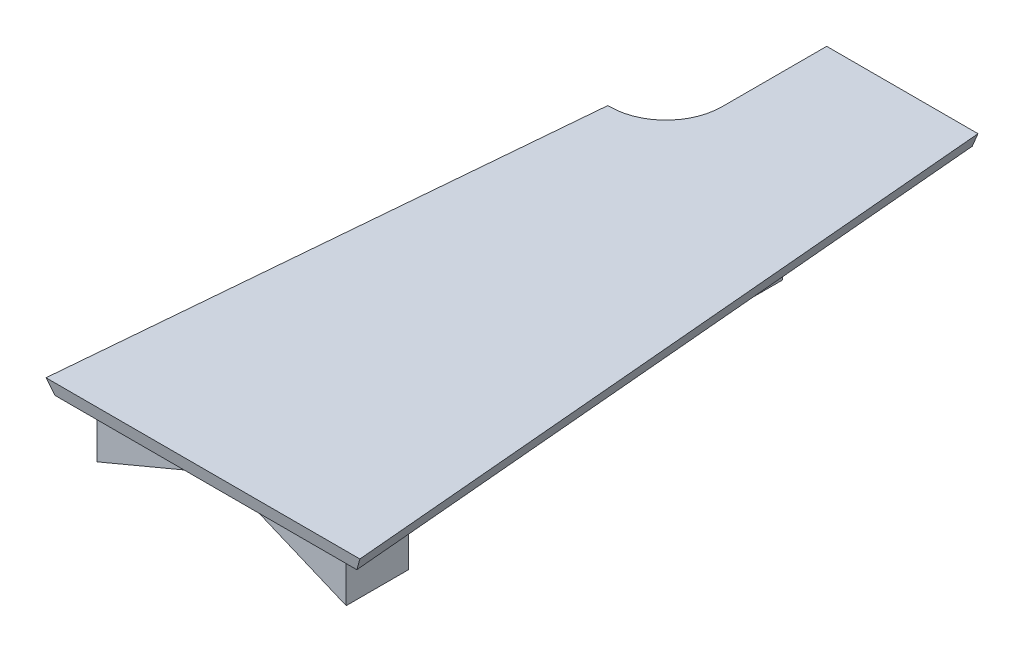
from build123d import *

# Parameters (mm, degrees)
SKIZZE1_W                            = 57
SKIZZE1_H                            = 123
AUFSATZ_LINEAR_AUSTRAGEN1_DEPTH      = 2.5
SCHNITT_LINEAR_AUSTRAGEN1_DEPTH      = 84.889808678
SCHNITT_LINEAR_AUSTRAGEN2_DEPTH      = 68.828828679
SCHNITT_LINEAR_AUSTRAGEN3_DEPTH      = 70.726045338
SCHNITT_LINEAR_AUSTRAGEN3_DEPTH_BACK = 70.726045338
SCHNITT_LINEAR_AUSTRAGEN4_DEPTH      = 70.47454308
SCHNITT_LINEAR_AUSTRAGEN4_DEPTH_BACK = 70.47454308
SKIZZE9_W                            = 45.241474544
SKIZZE9_H                            = 11.280630507
AUFSATZ_LINEAR_AUSTRAGEN2_DEPTH      = 13
SCHNITT_LINEAR_AUSTRAGEN5_DEPTH      = 20
SKIZZE12_W                           = 36.023643564
SKIZZE12_H                           = 10.472363364
AUFSATZ_LINEAR_AUSTRAGEN3_DEPTH      = 5
SCHNITT_LINEAR_AUSTRAGEN6_DEPTH      = 12
SCHNITT_LINEAR_AUSTRAGEN8_DEPTH      = 0.5
SCHNITT_LINEAR_AUSTRAGEN8_DEPTH_BACK = 1.65
SKIZZE16_R                           = 3.1
SCHNITT_LINEAR_AUSTRAGEN9_DEPTH      = 1.15
SCHNITT_LINEAR_AUSTRAGEN9_DEPTH_BACK = 1
SKIZZE17_R                           = 3.1
SCHNITT_LINEAR_AUSTRAGEN10_DEPTH     = 10


with BuildPart() as part:
    # Skizze1 → Aufsatz-Linear austragen1 (new body)
    with BuildSketch(Plane(origin=(0, 0, 0), x_dir=(1, 0, 0), z_dir=(0, 1, 0))):
        Rectangle(SKIZZE1_W, SKIZZE1_H)
    extrude(amount=AUFSATZ_LINEAR_AUSTRAGEN1_DEPTH)

    # Skizze2 → Schnitt-Linear austragen1 (cut, through all)
    with BuildSketch(Plane(origin=(28.5, 0, 0), x_dir=(0, 0, -1), z_dir=(1, 0, 0))):
        Polygon((-61.5, 2.5), (-61.5, 0), (-60.968608596, 0), align=None)
    extrude(amount=-SCHNITT_LINEAR_AUSTRAGEN1_DEPTH, mode=Mode.SUBTRACT)

    # Skizze3 → Schnitt-Linear austragen2 (cut, through all)
    with BuildSketch(Plane(origin=(0, 2.5, 0), x_dir=(1, 0, 0), z_dir=(0, 1, 0))):
        Polygon((-28.5, -61.5), (-17.738894386, 61.5), (-28.5, 61.5), align=None)
        Polygon((28.5, -61.5), (17.738894386, 61.5), (28.5, 61.5), align=None)
    extrude(amount=-SCHNITT_LINEAR_AUSTRAGEN2_DEPTH, mode=Mode.SUBTRACT)

    # Skizze5 → Schnitt-Linear austragen3 (cut, two sides: drawn at the far end of the back side and taken through both)
    with BuildSketch(Plane(origin=(0.175618176, 0, 2.007324937), x_dir=(0, -1, 0), z_dir=(0.08715574274765484, 0, 0.9961946980917459)).offset(-SCHNITT_LINEAR_AUSTRAGEN3_DEPTH_BACK)):
        Polygon((0.008562414, 23.031470717), (-2.5, 23.031470717), (0, 21.995936811), align=None)
    extrude(amount=SCHNITT_LINEAR_AUSTRAGEN3_DEPTH + SCHNITT_LINEAR_AUSTRAGEN3_DEPTH_BACK, mode=Mode.SUBTRACT)

    # Skizze6 → Schnitt-Linear austragen4 (cut, two sides: drawn at the far end of the back side and taken through both)
    with BuildSketch(Plane(origin=(-0.152372814, 0, 1.741629235), x_dir=(0, 1, 0), z_dir=(-0.08715574274766175, 0, 0.9961946980917452)).offset(-SCHNITT_LINEAR_AUSTRAGEN4_DEPTH_BACK)):
        Polygon((2.5, 23.031470717), (0, 21.995936811), (0, 23.031470717), align=None)
    extrude(amount=SCHNITT_LINEAR_AUSTRAGEN4_DEPTH + SCHNITT_LINEAR_AUSTRAGEN4_DEPTH_BACK, mode=Mode.SUBTRACT)

    # Skizze9 → Aufsatz-Linear austragen2 (add)
    with BuildSketch(Plane.XZ):
        with Locations((0, 52.468608596)):
            Rectangle(SKIZZE9_W, SKIZZE9_H)
    extrude(amount=AUFSATZ_LINEAR_AUSTRAGEN2_DEPTH)

    # Skizze11 → Schnitt-Linear austragen5 (cut)
    with BuildSketch(Plane(origin=(0, 0, 46.828293342), x_dir=(-1, 0, 0), z_dir=(0, 0, -1))):
        Polygon((-22.620737272, -9.484039906), (0, 0), (22.620737272, -9.484039906), (22.620737272, -13), (-22.620737272, -13), align=None)
    extrude(amount=-SCHNITT_LINEAR_AUSTRAGEN5_DEPTH, mode=Mode.SUBTRACT)

    # Skizze12 → Aufsatz-Linear austragen3 (add)
    with BuildSketch(Plane.XZ):
        with Locations((0, -20.5)):
            Rectangle(SKIZZE12_W, SKIZZE12_H)
    extrude(amount=AUFSATZ_LINEAR_AUSTRAGEN3_DEPTH)

    # Skizze13 → Schnitt-Linear austragen6 (cut)
    with BuildSketch(Plane(origin=(0, 0, -25.736181682), x_dir=(-1, 0, 0), z_dir=(0, 0, -1))):
        Polygon((-18.011821782, -2.5), (-7.183132097, 0), (7.183132097, 0), (18.011821782, -2.5), (18.011821782, -5), (-18.011821782, -5), align=None)
    extrude(amount=-SCHNITT_LINEAR_AUSTRAGEN6_DEPTH, mode=Mode.SUBTRACT)

    # Skizze16 → Schnitt-Linear austragen8 (cut, two sides: drawn at the far end of the back side and taken through both)
    with BuildSketch(Plane.XZ.offset(-SCHNITT_LINEAR_AUSTRAGEN8_DEPTH_BACK)):
        with Locations((12.59747694, -20.5)):
            Circle(SKIZZE16_R)
        with Locations((-12.59747694, -20.5)):
            Circle(SKIZZE16_R)
    extrude(amount=SCHNITT_LINEAR_AUSTRAGEN8_DEPTH + SCHNITT_LINEAR_AUSTRAGEN8_DEPTH_BACK, mode=Mode.SUBTRACT)

    # Skizze17 → Schnitt-Linear austragen9 (cut, two sides: drawn at the far end of the back side and taken through both)
    with BuildSketch(Plane(origin=(0, -4.742019953, 0), x_dir=(1, 0, 0), z_dir=(0, 1, 0)).offset(-SCHNITT_LINEAR_AUSTRAGEN9_DEPTH_BACK)):
        with Locations((-16.965552954, -52.468608596)):
            Circle(SKIZZE17_R)
        with Locations((16.965552954, -52.468608596)):
            Circle(SKIZZE17_R)
    extrude(amount=SCHNITT_LINEAR_AUSTRAGEN9_DEPTH + SCHNITT_LINEAR_AUSTRAGEN9_DEPTH_BACK, mode=Mode.SUBTRACT)

    # Skizze18 → Schnitt-Linear austragen10 (cut)
    with BuildSketch(Plane(origin=(0, 2.5, 0), x_dir=(1, 0, 0), z_dir=(0, 1, 0))):
        with BuildLine():
            Line((-9.738894386, 61.5), (-9.738894386, 42.49))
            ThreePointArc((-9.738894386, 42.49), (-12.718555412, 35.29646194), (-19.912093472, 32.316800915))
            Line((-19.912093472, 32.316800915), (-20.292093472, 32.316800915))
            Line((-20.292093472, 32.316800915), (-17.738894386, 61.5))
            Line((-17.738894386, 61.5), (-9.738894386, 61.5))
        make_face()
    extrude(amount=-SCHNITT_LINEAR_AUSTRAGEN10_DEPTH, mode=Mode.SUBTRACT)


solid = part.part
